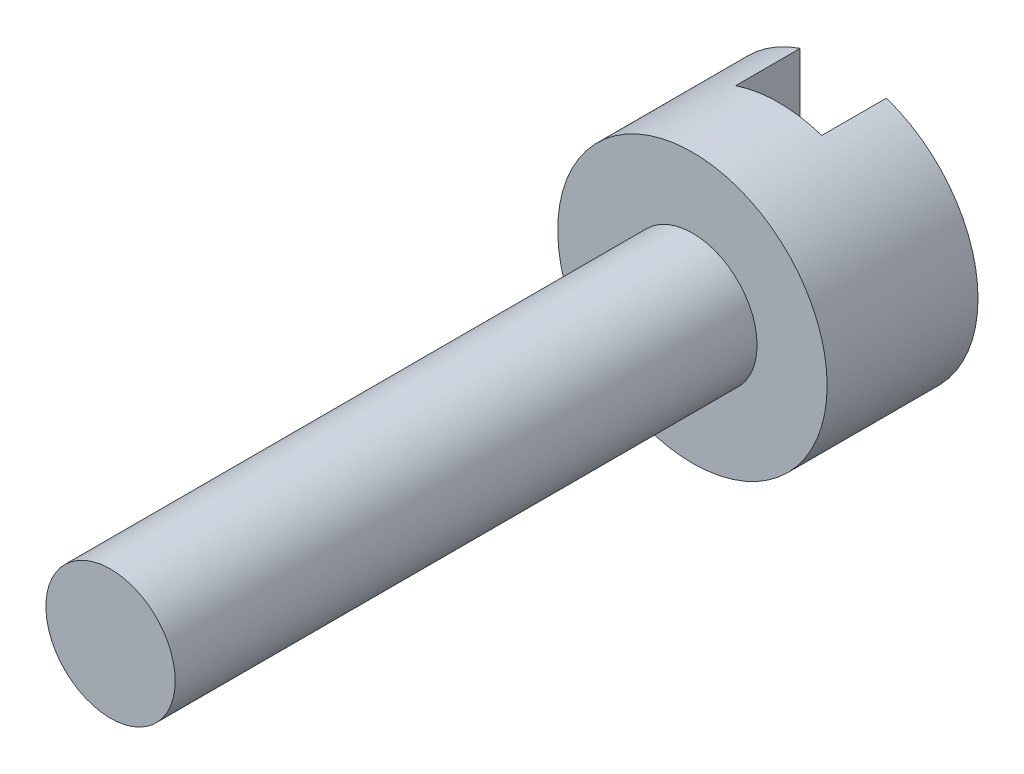
from build123d import *

# Parameters (mm, degrees)
SKETCH1_R           = 0.625
BOSS_EXTRUDE1_DEPTH = 0.7
SKETCH3_R           = 0.3
BOSS_EXTRUDE2_DEPTH = 2.7
SKETCH5_W           = 0.4
SKETCH5_H           = 2
CUT_EXTRUDE1_DEPTH  = 0.3


with BuildPart() as part:
    # Sketch1 → Boss-Extrude1 (new body)
    with BuildSketch(Plane.XY):
        Circle(SKETCH1_R)
    extrude(amount=BOSS_EXTRUDE1_DEPTH)

    # Sketch3 → Boss-Extrude2 (add)
    with BuildSketch(Plane.XY.offset(0.7)):
        Circle(SKETCH3_R)
    extrude(amount=BOSS_EXTRUDE2_DEPTH)

    # Sketch5 → Cut-Extrude1 (cut)
    with BuildSketch(Plane(origin=(0, 0, 0), x_dir=(-1, 0, 0), z_dir=(0, 0, -1))):
        Rectangle(SKETCH5_W, SKETCH5_H)
    extrude(amount=-CUT_EXTRUDE1_DEPTH, mode=Mode.SUBTRACT)


solid = part.part
